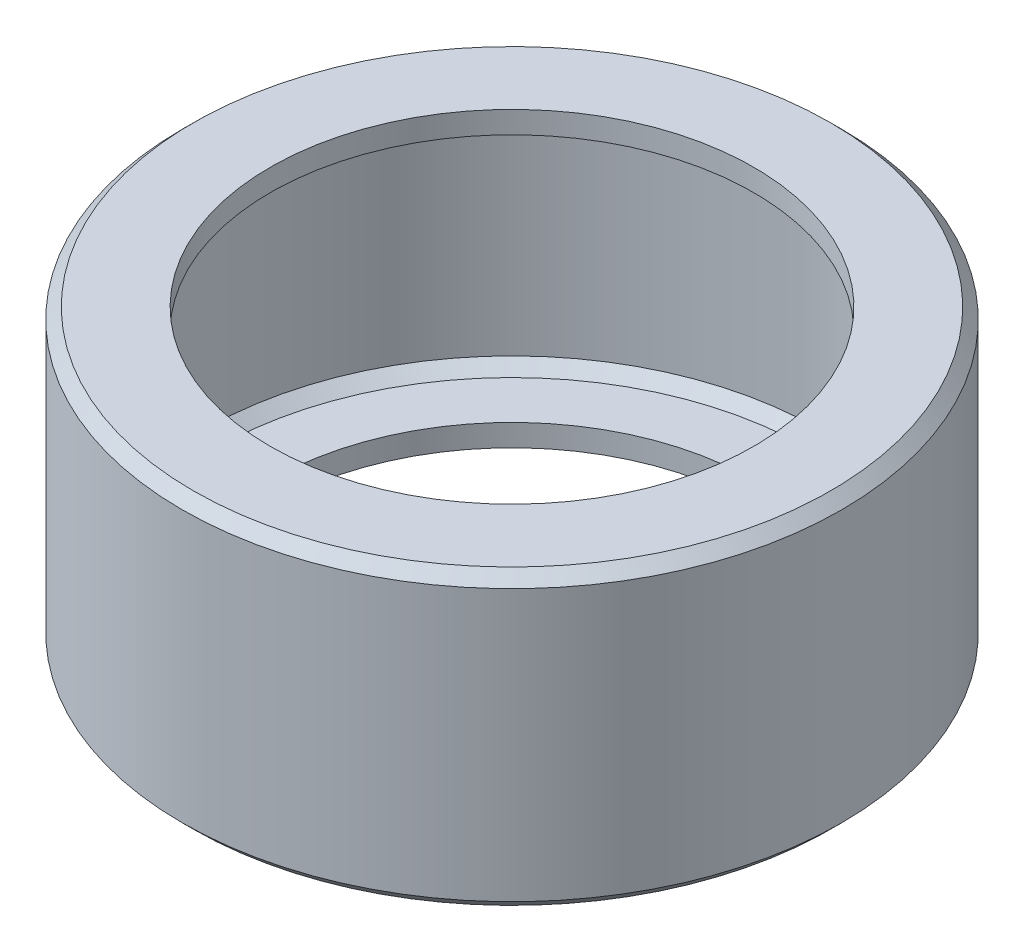
from build123d import *

# Parameters (mm, degrees)
SKETCH1_R           = 4.5
SKETCH1_R_2         = 4.2
BOSS_EXTRUDE1_DEPTH = 1.7
SKETCH2_R           = 4.5
SKETCH2_R_2         = 3.3
BOSS_EXTRUDE2_DEPTH = 0.3
CHAMFER1_SIZE       = 0.15
CHAMFER2_SIZE       = 0.15


with BuildPart() as part:
    # Sketch1 → Boss-Extrude1 (new body)
    with BuildSketch(Plane(origin=(0, 0, 0), x_dir=(1, 0, 0), z_dir=(0, 1, 0))):
        with Locations(Location((0, 0, 0), (0, 0, 270))):
            Circle(SKETCH1_R)
        with Locations(Location((0, 0, 0), (0, 0, 270))):
            Circle(SKETCH1_R_2, mode=Mode.SUBTRACT)
    extrude(amount=BOSS_EXTRUDE1_DEPTH)

    # Sketch2 → Boss-Extrude2 (add)
    with BuildSketch(Plane(origin=(0, 1.7, 0), x_dir=(1, 0, 0), z_dir=(0, 1, 0))):
        with Locations(Location((0, 0, 0), (0, 0, 270))):
            Circle(SKETCH2_R)
        with Locations(Location((0, 0, 0), (0, 0, 270))):
            Circle(SKETCH2_R_2, mode=Mode.SUBTRACT)
    extrude(amount=BOSS_EXTRUDE2_DEPTH)

    # Chamfer1
    chamfer1_edges = [part.edges().sort_by_distance(p)[0] for p in [
        (0, 2, -4.5),
    ]]
    chamfer(chamfer1_edges, length=CHAMFER1_SIZE)

    # Chamfer2
    chamfer2_edges = [part.edges().sort_by_distance(p)[0] for p in [
        (0, 1.7, -4.2),
    ]]
    chamfer(chamfer2_edges, length=CHAMFER2_SIZE)

    # Mirror1: part across plane


with BuildPart() as part_1:
    add(part.part)
    add(part.part.mirror(Plane.ZX))


solid = part_1.part
